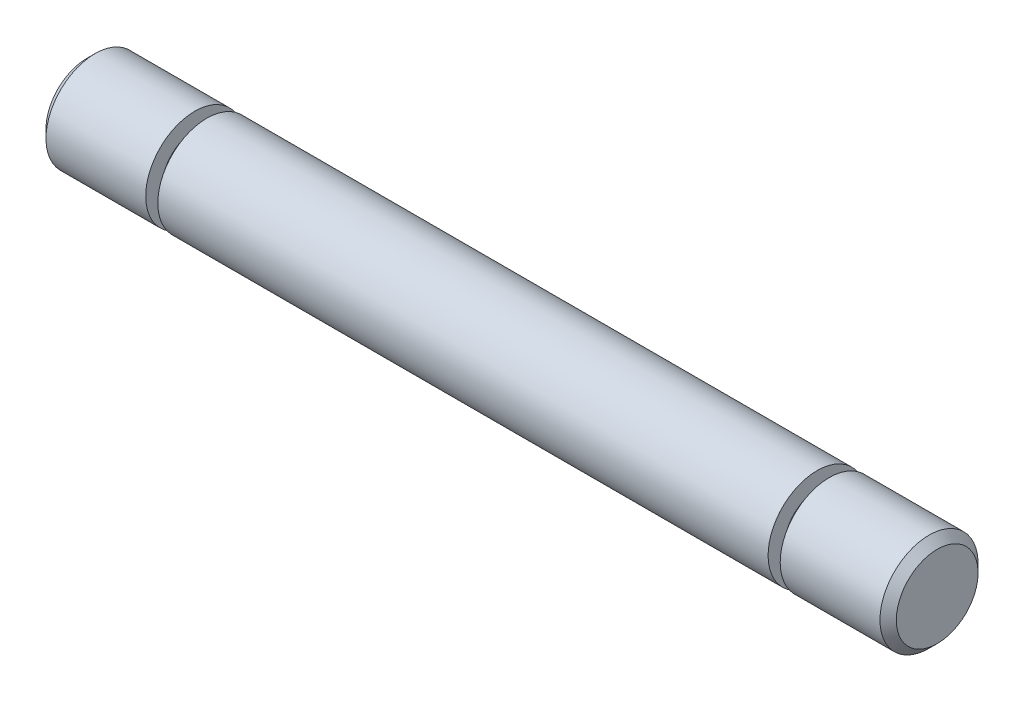
from build123d import *

# Parameters (mm, degrees)
ESQUISSE1_W     = 52
ESQUISSE1_H     = 3
CHANFREIN1_SIZE = 0.5
ESQUISSE3_W     = 0.74
ESQUISSE3_H     = 1


with BuildPart() as part:
    # Esquisse1 → Révolution1 (revolve)
    with BuildSketch(Plane.XY, mode=Mode.PRIVATE) as r_volution1_sk:
        with Locations((0, 1.5)):
            Rectangle(ESQUISSE1_W, ESQUISSE1_H)
    revolve(r_volution1_sk.sketch.rotate(Axis((0, 0, 0), (1, 0, 0)), 90), axis=Axis((0, 0, 0), (1, 0, 0)))

    # Chanfrein1
    chanfrein1_edges = [part.edges().sort_by_distance(p)[0] for p in [
        (26, 0, -3),
        (-26, 0, -3),
    ]]
    chamfer(chanfrein1_edges, length=CHANFREIN1_SIZE)

    # Esquisse3 → Enlèvement de matière-Révolution1 (revolve, cut)
    with BuildSketch(Plane.XY):
        with Locations((-19.03, 2.5)):
            Rectangle(ESQUISSE3_W, ESQUISSE3_H)
        with Locations((19.03, 2.5)):
            Rectangle(ESQUISSE3_W, ESQUISSE3_H)
    revolve(axis=Axis((0, 0, 0), (-1, 0, 0)), mode=Mode.SUBTRACT)


solid = part.part
